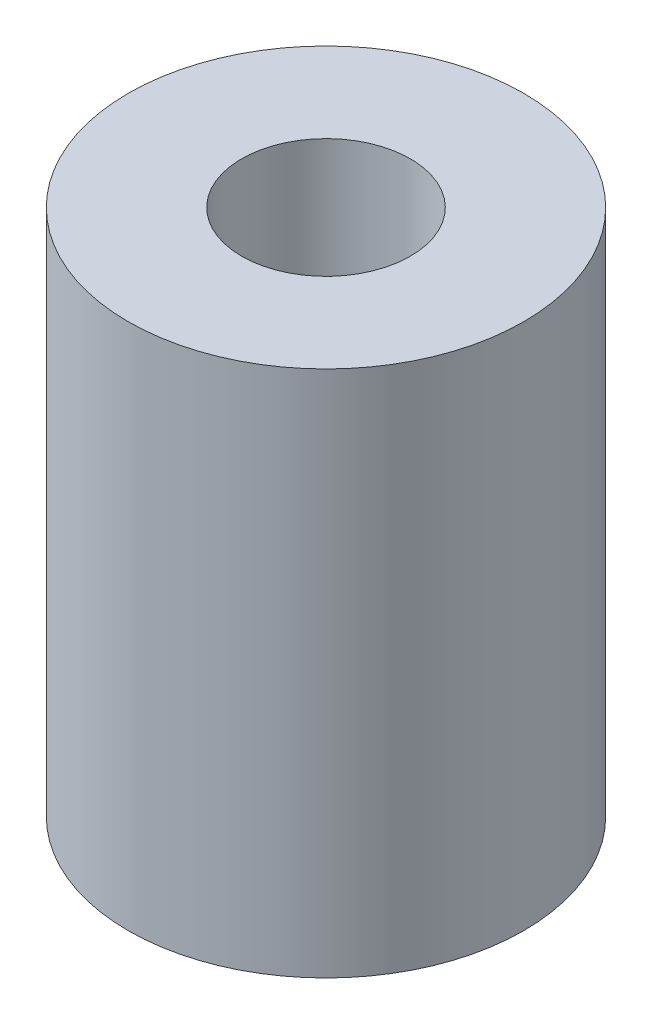
from build123d import *

# Parameters (mm, degrees)
SKETCH1_R           = 4.7625
SKETCH1_R_2         = 2.032
BOSS_EXTRUDE1_DEPTH = 12.7


with BuildPart() as part:
    # Sketch1 → Boss-Extrude1 (new body)
    with BuildSketch(Plane(origin=(0, 0, 0), x_dir=(1, 0, 0), z_dir=(0, 1, 0))):
        with Locations(Location((0, 0, 0), (0, 0, 270))):
            Circle(SKETCH1_R)
        with Locations(Location((0, 0, 0), (0, 0, 270))):
            Circle(SKETCH1_R_2, mode=Mode.SUBTRACT)
    extrude(amount=BOSS_EXTRUDE1_DEPTH)


solid = part.part
